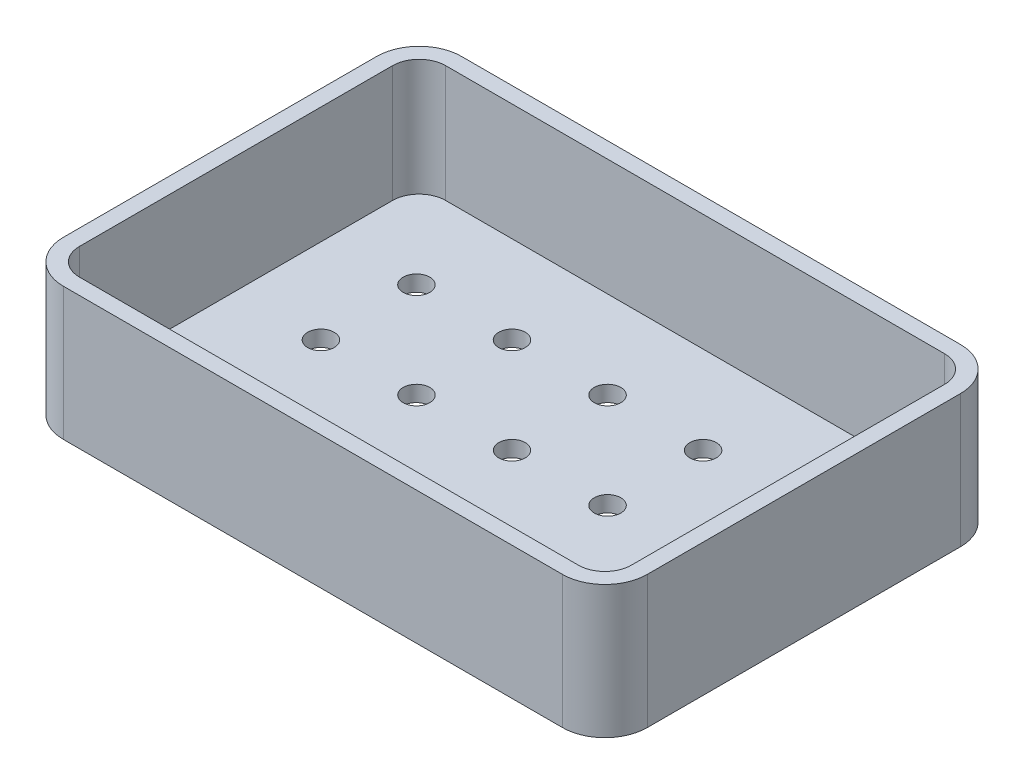
from build123d import *

# Parameters (mm, degrees)
EXTRUDE_1_DEPTH     = 25
CUT_EXTRUDE_1_DEPTH = 22
SKETCH_3_R          = 2.5
CUT_EXTRUDE_2_DEPTH = 72.107313267


with BuildPart() as part:
    # 草图1 → 凸台-拉伸1 (new body)
    with BuildSketch(Plane(origin=(0, 0, 0), x_dir=(1, 0, 0), z_dir=(0, 1, 0))):
        with BuildLine():
            Line((-47, 37.5), (47, 37.5))
            ThreePointArc((47, 37.5), (52.656854249, 35.156854249), (55, 29.5))
            Line((55, 29.5), (55, -29.5))
            ThreePointArc((55, -29.5), (52.656854249, -35.156854249), (47, -37.5))
            Line((47, -37.5), (-47, -37.5))
            ThreePointArc((-47, -37.5), (-52.656854249, -35.156854249), (-55, -29.5))
            Line((-55, -29.5), (-55, 29.5))
            ThreePointArc((-55, 29.5), (-52.656854249, 35.156854249), (-47, 37.5))
        make_face()
    extrude(amount=-EXTRUDE_1_DEPTH)

    # 草图2 → 切除-拉伸1 (cut)
    with BuildSketch(Plane(origin=(0, -22, 0), x_dir=(1, 0, 0), z_dir=(0, 1, 0))):
        with BuildLine():
            Line((-47, 34.5), (47, 34.5))
            ThreePointArc((47, 34.5), (50.535533906, 33.035533906), (52, 29.5))
            Line((52, 29.5), (52, -29.5))
            ThreePointArc((52, -29.5), (50.535533906, -33.035533906), (47, -34.5))
            Line((47, -34.5), (-47, -34.5))
            ThreePointArc((-47, -34.5), (-50.535533906, -33.035533906), (-52, -29.5))
            Line((-52, -29.5), (-52, 29.5))
            ThreePointArc((-52, 29.5), (-50.535533906, 33.035533906), (-47, 34.5))
        make_face()
    extrude(amount=CUT_EXTRUDE_1_DEPTH, mode=Mode.SUBTRACT)

    # 草图3 → 切除-拉伸2 (cut, through all)
    with BuildSketch(Plane(origin=(0, -25, 0), x_dir=(1, 0, 0), z_dir=(0, 1, 0))):
        with Locations(Location((-36, 18, 0), (0, 0, 90))):
            Circle(SKETCH_3_R)
        with Locations(Location((-18, 18, 0), (0, 0, 90))):
            Circle(SKETCH_3_R)
        with Locations(Location((0, 18, 0), (0, 0, 90))):
            Circle(SKETCH_3_R)
        with Locations(Location((18, 18, 0), (0, 0, 90))):
            Circle(SKETCH_3_R)
        with Locations(Location((36, 18, 0), (0, 0, 90))):
            Circle(SKETCH_3_R)
        with Locations(Location((-36, 0, 0), (0, 0, 90))):
            Circle(SKETCH_3_R)
        with Locations(Location((-18, 0, 0), (0, 0, 90))):
            Circle(SKETCH_3_R)
        with Locations(Location((0, 0, 0), (0, 0, 90))):
            Circle(SKETCH_3_R)
        with Locations(Location((18, 0, 0), (0, 0, 90))):
            Circle(SKETCH_3_R)
        with Locations(Location((36, 0, 0), (0, 0, 90))):
            Circle(SKETCH_3_R)
        with Locations(Location((-36, -18, 0), (0, 0, 90))):
            Circle(SKETCH_3_R)
        with Locations(Location((-18, -18, 0), (0, 0, 90))):
            Circle(SKETCH_3_R)
        with Locations(Location((0, -18, 0), (0, 0, 90))):
            Circle(SKETCH_3_R)
        with Locations(Location((18, -18, 0), (0, 0, 90))):
            Circle(SKETCH_3_R)
        with Locations(Location((36, -18, 0), (0, 0, 90))):
            Circle(SKETCH_3_R)
    extrude(amount=CUT_EXTRUDE_2_DEPTH, mode=Mode.SUBTRACT)


solid = part.part
